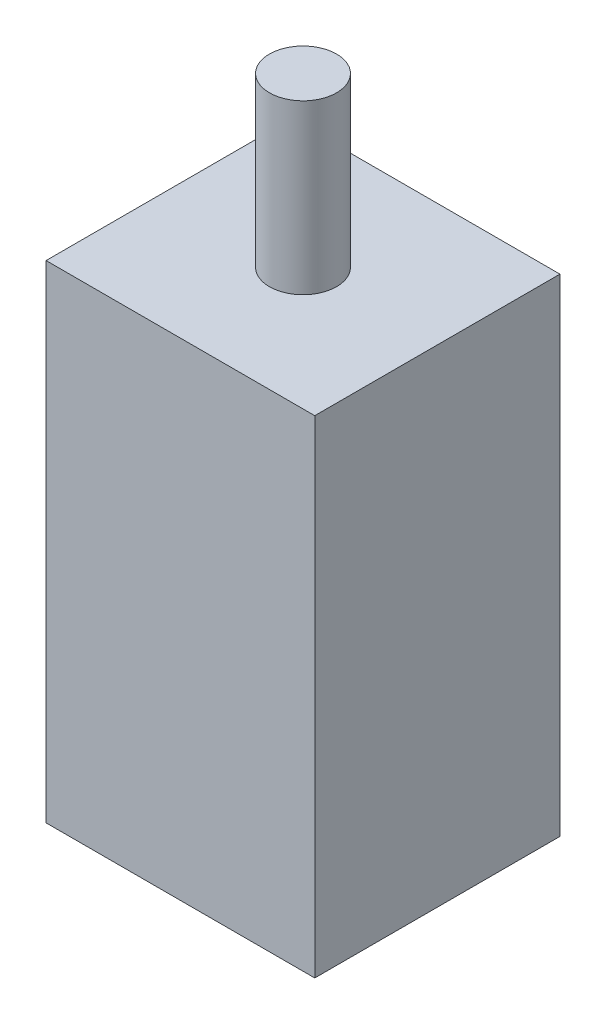
from build123d import *

# Parameters (mm, degrees)
CROQUIS1_W              = 16
CROQUIS1_H              = 14.6
SALIENTE_EXTRUIR1_DEPTH = 29
CROQUIS2_R              = 2
SALIENTE_EXTRUIR2_DEPTH = 10


with BuildPart() as part:
    # Croquis1 → Saliente-Extruir1 (new body)
    with BuildSketch(Plane(origin=(0, 0, 0), x_dir=(1, 0, 0), z_dir=(0, 1, 0))):
        with Locations((0.814814815, 4.003703704)):
            Rectangle(CROQUIS1_W, CROQUIS1_H)
    extrude(amount=SALIENTE_EXTRUIR1_DEPTH)

    # Croquis2 → Saliente-Extruir2 (add)
    with BuildSketch(Plane(origin=(0, 29, 0), x_dir=(1, 0, 0), z_dir=(0, 1, 0))):
        with Locations(Location((0.814814815, 4.003703704, 0), (0, 0, 270))):
            Circle(CROQUIS2_R)
    extrude(amount=SALIENTE_EXTRUIR2_DEPTH)


solid = part.part
